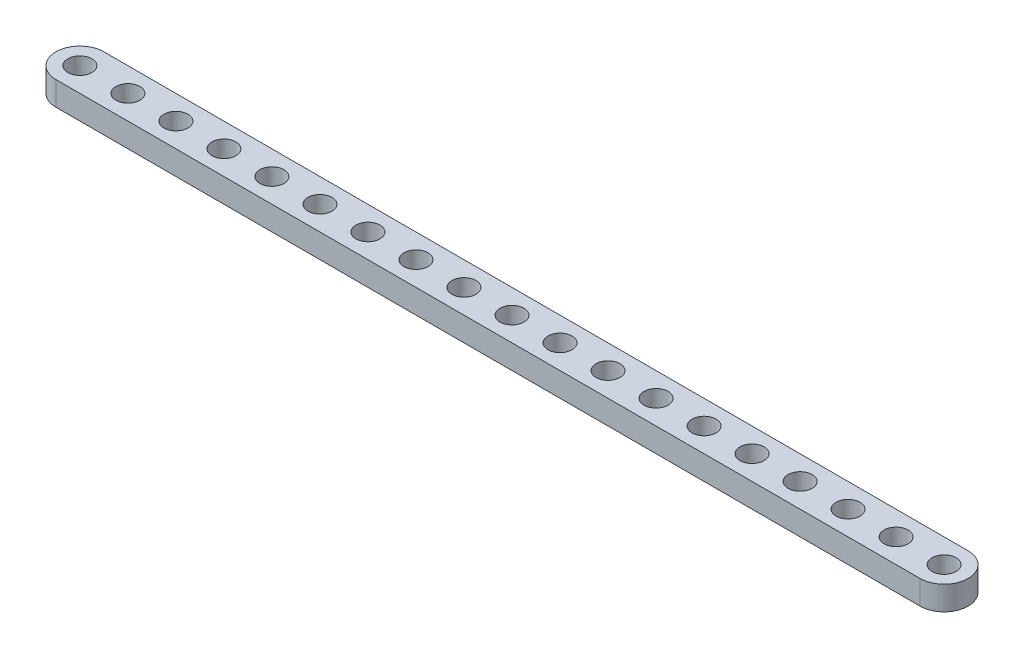
from build123d import *

# Parameters (mm, degrees)
SKETCH1_R           = 2
BOSS_EXTRUDE1_DEPTH = 4


with BuildPart() as part:
    # Sketch1 → Boss-Extrude1 (new body)
    with BuildSketch(Plane.XZ):
        with BuildLine():
            Line((-72, -4), (72, -4))
            ThreePointArc((72, -4), (76, 0), (72, 4))
            Line((72, 4), (-72, 4))
            ThreePointArc((-72, 4), (-76, 0), (-72, -4))
        make_face()
        with Locations(Location((-72, 0, 0), (0, 0, 90))):
            Circle(SKETCH1_R, mode=Mode.SUBTRACT)
        with Locations(Location((-64, 0, 0), (0, 0, 90))):
            Circle(SKETCH1_R, mode=Mode.SUBTRACT)
        with Locations(Location((-56, 0, 0), (0, 0, 90))):
            Circle(SKETCH1_R, mode=Mode.SUBTRACT)
        with Locations(Location((-48, 0, 0), (0, 0, 90))):
            Circle(SKETCH1_R, mode=Mode.SUBTRACT)
        with Locations(Location((-40, 0, 0), (0, 0, 90))):
            Circle(SKETCH1_R, mode=Mode.SUBTRACT)
        with Locations(Location((-32, 0, 0), (0, 0, 90))):
            Circle(SKETCH1_R, mode=Mode.SUBTRACT)
        with Locations(Location((-24, 0, 0), (0, 0, 90))):
            Circle(SKETCH1_R, mode=Mode.SUBTRACT)
        with Locations(Location((-16, 0, 0), (0, 0, 90))):
            Circle(SKETCH1_R, mode=Mode.SUBTRACT)
        with Locations(Location((-8, 0, 0), (0, 0, 90))):
            Circle(SKETCH1_R, mode=Mode.SUBTRACT)
        with Locations(Location((0, 0, 0), (0, 0, 90))):
            Circle(SKETCH1_R, mode=Mode.SUBTRACT)
        with Locations(Location((8, 0, 0), (0, 0, 90))):
            Circle(SKETCH1_R, mode=Mode.SUBTRACT)
        with Locations(Location((16, 0, 0), (0, 0, 90))):
            Circle(SKETCH1_R, mode=Mode.SUBTRACT)
        with Locations(Location((24, 0, 0), (0, 0, 90))):
            Circle(SKETCH1_R, mode=Mode.SUBTRACT)
        with Locations(Location((32, 0, 0), (0, 0, 90))):
            Circle(SKETCH1_R, mode=Mode.SUBTRACT)
        with Locations(Location((40, 0, 0), (0, 0, 90))):
            Circle(SKETCH1_R, mode=Mode.SUBTRACT)
        with Locations(Location((48, 0, 0), (0, 0, 90))):
            Circle(SKETCH1_R, mode=Mode.SUBTRACT)
        with Locations(Location((56, 0, 0), (0, 0, 90))):
            Circle(SKETCH1_R, mode=Mode.SUBTRACT)
        with Locations(Location((64, 0, 0), (0, 0, 90))):
            Circle(SKETCH1_R, mode=Mode.SUBTRACT)
        with Locations(Location((72, 0, 0), (0, 0, 90))):
            Circle(SKETCH1_R, mode=Mode.SUBTRACT)
    extrude(amount=-BOSS_EXTRUDE1_DEPTH)


solid = part.part
